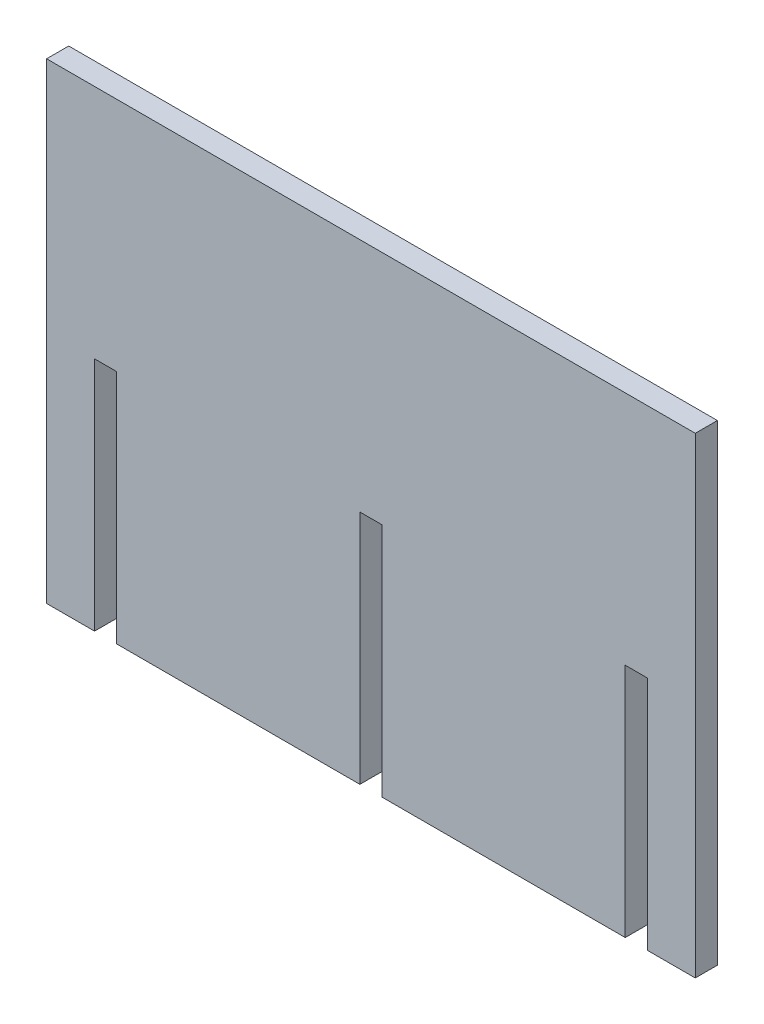
from build123d import *

# Parameters (mm, degrees)
SKETCH1_W           = 139.7
SKETCH1_H           = 101.6
BOSS_EXTRUDE1_DEPTH = 4.7625
SKETCH2_W           = 4.7625
SKETCH2_H           = 101.6
CUT_EXTRUDE1_DEPTH  = 87.500542809
LPATTERN1_COUNT     = 3
LPATTERN1_PITCH     = 57.15


with BuildPart() as part:
    # Sketch1 → Boss-Extrude1 (new body)
    with BuildSketch(Plane.XY):
        Rectangle(SKETCH1_W, SKETCH1_H)
    extrude(amount=BOSS_EXTRUDE1_DEPTH)

    # Sketch2 → Cut-Extrude1 (cut, through all)
    with BuildSketch(Plane.XY.offset(4.7625)):
        with Locations((-57.15, -50.8)):
            Rectangle(SKETCH2_W, SKETCH2_H)
    cut_extrude1 = extrude(amount=-CUT_EXTRUDE1_DEPTH, mode=Mode.SUBTRACT)

    # LPattern1: Cut-Extrude1 ×3
    with Locations(*[(i * LPATTERN1_PITCH, 0, 0) for i in range(1, LPATTERN1_COUNT)]):
        add(cut_extrude1, mode=Mode.SUBTRACT)


solid = part.part
